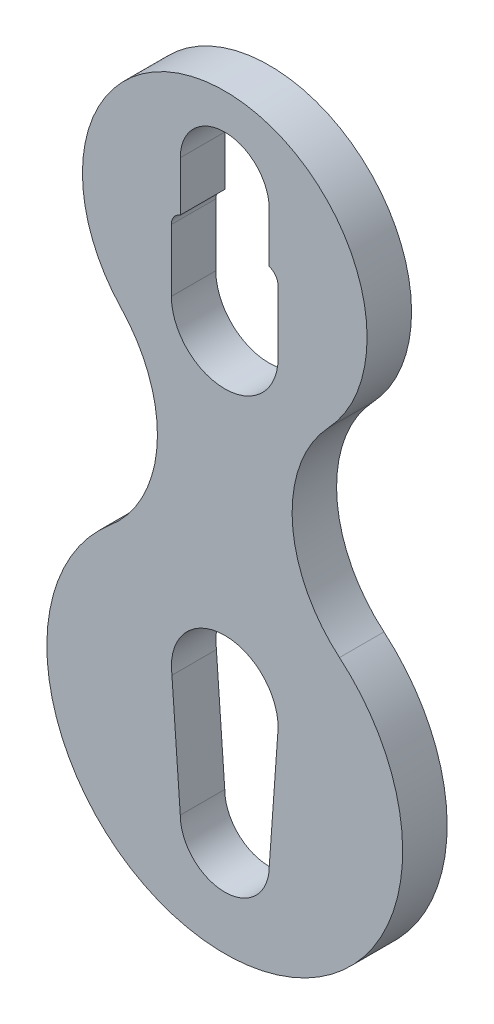
from build123d import *

# Parameters (mm, degrees)
BOSS_EXTRUDE1_DEPTH = 5


with BuildPart() as part:
    # Sketch1 → Boss-Extrude1 (new, symmetric)
    # profile 1 of 2: a face of its own
    with BuildSketch(Plane.XY):
        with BuildLine():
            ThreePointArc((23.298809999, 74.064516129), (29.376312637, 108.689848536), (1.88e-07, 128))
            ThreePointArc((1.88e-07, 128), (-29.376312562, 108.689848709), (-23.298809999, 74.064516129))
            ThreePointArc((-23.298809999, 74.064516129), (-15.190736019, 51.78096855), (-25.79511107, 30.571428571))
            ThreePointArc((-25.79511107, 30.571428571), (0, -40), (25.79511107, 30.571428571))
            ThreePointArc((25.79511107, 30.571428571), (15.190736019, 51.78096855), (23.298809999, 74.064516129))
        make_face()
        with BuildLine():
            ThreePointArc((-11.878172589, 8.294416244), (-11.969504398, 9.1450354), (-12, 10))
            ThreePointArc((-12, 10), (0, 22), (12, 10))
            ThreePointArc((12, 10), (11.969504398, 9.1450354), (11.878172589, 8.294416244))
            Line((11.878172589, 8.294416244), (10, -18))
            ThreePointArc((10, -18), (0, -28), (-10, -18))
            Line((-10, -18), (-11.878172589, 8.294416244))
        make_face(mode=Mode.SUBTRACT)
        with BuildLine():
            ThreePointArc((22, 82), (0, 60), (-22, 82))
            Line((-22, 82), (-22, 106))
            ThreePointArc((-22, 106), (-15.55634912, 121.556349253), (1.88e-07, 128))
            ThreePointArc((1.88e-07, 128), (15.556349253, 121.55634912), (22, 106))
            Line((22, 106), (22, 82))
        make_face(mode=Mode.SUBTRACT)
    # profile 2 of 2: a face of its own
    with BuildSketch(Plane.XY):
        with BuildLine():
            Line((22, 82), (22, 106))
            ThreePointArc((22, 106), (0, 128), (-22, 106))
            Line((-22, 106), (-22, 82))
            ThreePointArc((-22, 82), (0, 60), (22, 82))
        make_face()
        with BuildLine():
            Line((10, 110), (10, 98.828427125))
            ThreePointArc((10, 98.828427125), (11.449489743, 97.732050808), (12, 96))
            Line((12, 96), (12, 82))
            ThreePointArc((12, 82), (0, 70), (-12, 82))
            Line((-12, 82), (-12, 96))
            ThreePointArc((-12, 96), (-11.449489743, 97.732050808), (-10, 98.828427125))
            Line((-10, 98.828427125), (-10, 110))
            ThreePointArc((-10, 110), (0, 120), (10, 110))
        make_face(mode=Mode.SUBTRACT)
    extrude(amount=BOSS_EXTRUDE1_DEPTH, both=True)


solid = part.part
